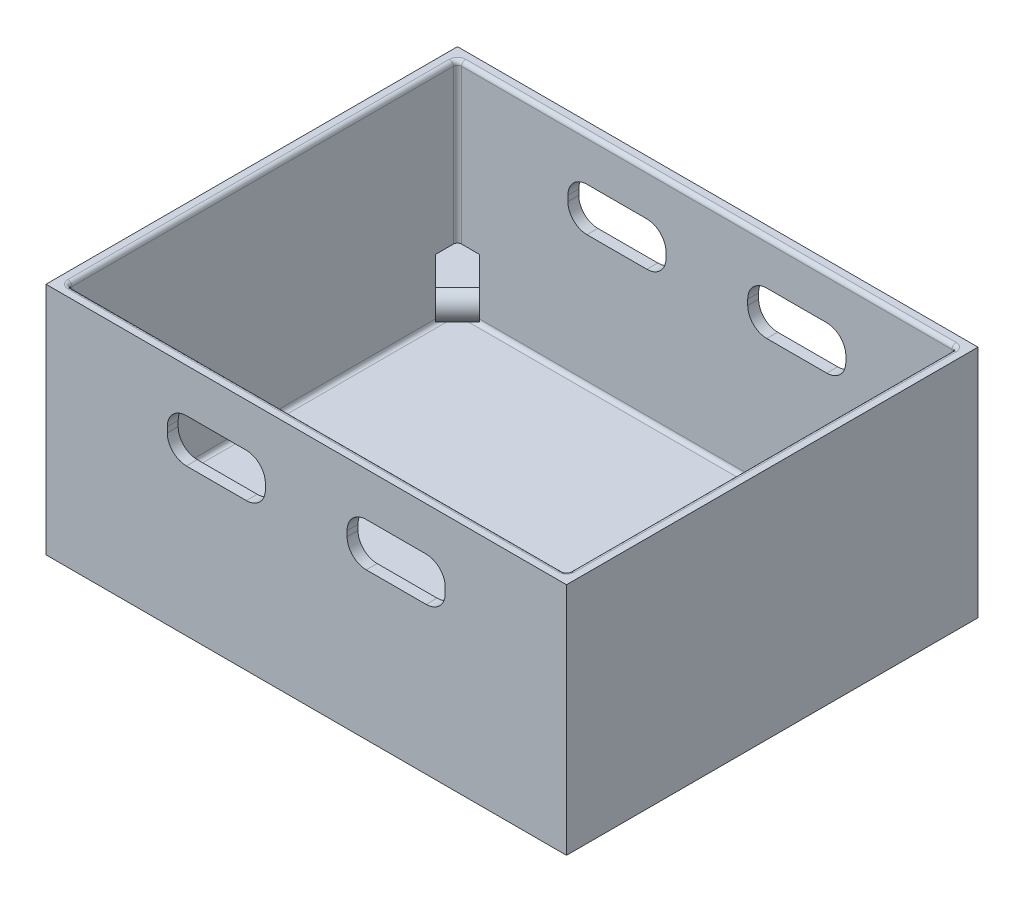
from build123d import *

# Parameters (mm, degrees)
SKETCH1_W            = 95.5
SKETCH1_H            = 75.5
SKETCH1_W_2          = 91.5
SKETCH1_H_2          = 71.5
EXTRUDE_THIN1_DEPTH  = 40
SKETCH2_W            = 95.5
SKETCH2_H            = 75.5
BOSS_EXTRUDE1_DEPTH  = 3
CUT_EXTRUDE1_DEPTH   = 98.879070797
BOSS_EXTRUDE3_START  = 11
BOSS_EXTRUDE3_DEPTH  = 9
CUT_EXTRUDE2_REACH   = 83.241
MIRROR2_START        = 11
MIRROR2_COPY_1_DEPTH = 9
MIRROR2_COPY_2_REACH = 83.241
FILLET3_R            = 0.75
FILLET4_R            = 0.75


with BuildPart() as part:
    # Sketch1 → Extrude-Thin1 (new body)
    with BuildSketch(Plane(origin=(0, 0, 0), x_dir=(1, 0, 0), z_dir=(0, 1, 0))):
        Rectangle(SKETCH1_W, SKETCH1_H)
        Rectangle(SKETCH1_W_2, SKETCH1_H_2, mode=Mode.SUBTRACT)
    extrude(amount=EXTRUDE_THIN1_DEPTH)

    # Sketch2 → Boss-Extrude1 (add)
    with BuildSketch(Plane.XZ):
        Rectangle(SKETCH2_W, SKETCH2_H)
    extrude(amount=BOSS_EXTRUDE1_DEPTH)

    # Sketch4 → Cut-Extrude1 (cut, through all)
    with BuildSketch(Plane.XY.offset(37.75)):
        with BuildLine():
            Line((-22, 32), (-11, 32))
            ThreePointArc((-11, 32), (-8.525126266, 30.974873734), (-7.5, 28.5))
            Line((-7.5, 28.5), (-7.5, 27.5))
            ThreePointArc((-7.5, 27.5), (-8.525126266, 25.025126266), (-11, 24))
            Line((-11, 24), (-22, 24))
            ThreePointArc((-22, 24), (-24.474873734, 25.025126266), (-25.5, 27.5))
            Line((-25.5, 27.5), (-25.5, 28.5))
            ThreePointArc((-25.5, 28.5), (-24.474873734, 30.974873734), (-22, 32))
        make_face()
        with BuildLine():
            Line((11, 32), (22, 32))
            ThreePointArc((22, 32), (24.474873734, 30.974873734), (25.5, 28.5))
            Line((25.5, 28.5), (25.5, 27.5))
            ThreePointArc((25.5, 27.5), (24.474873734, 25.025126266), (22, 24))
            Line((22, 24), (11, 24))
            ThreePointArc((11, 24), (8.525126266, 25.025126266), (7.5, 27.5))
            Line((7.5, 27.5), (7.5, 28.5))
            ThreePointArc((7.5, 28.5), (8.525126266, 30.974873734), (11, 32))
        make_face()
    extrude(amount=-CUT_EXTRUDE1_DEPTH, mode=Mode.SUBTRACT)

    # Sketch7 → Boss-Extrude3 (add)
    with BuildSketch(Plane(origin=(0, 0, 0), x_dir=(1, 0, 0), z_dir=(0, 1, 0)).offset(BOSS_EXTRUDE3_START)):
        Polygon((-45.75, 35.75), (-45.75, 31.75), (-38.678932188, 24.678932188), (-34.678932188, 28.678932188), (-41.75, 35.75), align=None)
    boss_extrude3 = extrude(amount=-BOSS_EXTRUDE3_DEPTH)

    # Sketch8 → Cut-Extrude2 (cut, up to next)
    with BuildSketch(Plane(origin=(-7, 0, 7), x_dir=(0.7071067811865489, 0, 0.7071067811865461), z_dir=(-0.7071067811865461, 0, 0.7071067811865489)), mode=Mode.PRIVATE) as cut_extrude2_sk1:
        with BuildLine():
            ThreePointArc((-47.300775542, 11), (-45.423796616, 8.62675879), (-46.800775542, 5.932458739))
            Line((-46.800775542, 5.932458739), (-53.550775542, 2))
            Line((-53.550775542, 2), (-44.800775542, 2))
            Line((-44.800775542, 2), (-44.800775542, 11))
            Line((-44.800775542, 11), (-47.300775542, 11))
        make_face()
    cut_extrude2_tool1 = extrude(cut_extrude2_sk1.sketch, amount=-CUT_EXTRUDE2_REACH, mode=Mode.PRIVATE) & part.part
    cut_extrude2 = cut_extrude2_tool1.solids().sort_by_distance((-40.481625, 4.582192, -26.481625))[0]
    add(cut_extrude2, mode=Mode.SUBTRACT)

    # Mirror1: Boss-Extrude3, Cut-Extrude2 across plane
    add(boss_extrude3.mirror(Plane.XY))
    add(cut_extrude2.mirror(Plane.XY), mode=Mode.SUBTRACT)

    # Mirror2: Boss-Extrude3, Cut-Extrude2 across plane
    add(boss_extrude3.mirror(Plane(origin=(0, 0, 0), x_dir=(0, 0, 1), z_dir=(1, 0, 0))))
    add(cut_extrude2.mirror(Plane(origin=(0, 0, 0), x_dir=(0, 0, 1), z_dir=(1, 0, 0))), mode=Mode.SUBTRACT)

    # Mirror2 copy 1 sketch → Mirror2 copy 1 (add)
    with BuildSketch(Plane(origin=(0, 0, 0), x_dir=(-1, 0, 0), z_dir=(0, 1, 0)).offset(MIRROR2_START)):
        Polygon((-45.75, 35.75), (-45.75, 31.75), (-38.678932188, 24.678932188), (-34.678932188, 28.678932188), (-41.75, 35.75), align=None)
    extrude(amount=-MIRROR2_COPY_1_DEPTH)

    # Mirror2 copy 2 sketch → Mirror2 copy 2 (cut, up to next)
    with BuildSketch(Plane(origin=(7, 0, -7), x_dir=(-0.7071067811865489, 0, -0.7071067811865461), z_dir=(0.7071067811865461, 0, -0.7071067811865489)), mode=Mode.PRIVATE) as mirror2_copy_2_sk1:
        with BuildLine():
            ThreePointArc((-47.300775542, 11), (-45.423796616, 8.62675879), (-46.800775542, 5.932458739))
            Line((-46.800775542, 5.932458739), (-53.550775542, 2))
            Line((-53.550775542, 2), (-44.800775542, 2))
            Line((-44.800775542, 2), (-44.800775542, 11))
            Line((-44.800775542, 11), (-47.300775542, 11))
        make_face()
    mirror2_copy_2_tool1 = extrude(mirror2_copy_2_sk1.sketch, amount=-MIRROR2_COPY_2_REACH, mode=Mode.PRIVATE) & part.part
    add(mirror2_copy_2_tool1.solids().sort_by_distance((40.481625, 4.582192, 26.481625))[0], mode=Mode.SUBTRACT)

    # Fillet3
    fillet3_edges = [part.edges().sort_by_distance(p)[0] for p in [
        (-45.75, 0, 0),
        (0, 0, 35.75),
        (45.75, 0, 0),
        (0, 0, -35.75),
        (45.75, 25.5, 35.75),
        (45.75, 25.5, -35.75),
        (-45.75, 25.5, -35.75),
        (-45.75, 25.5, 35.75),
    ]]
    fillet(fillet3_edges, radius=FILLET3_R)

    # Fillet4
    fillet4_edges = [part.edges().sort_by_distance(p)[0] for p in [
        (-45.530330086, 40, -35.530330086),
        (0, 40, -35.75),
        (45.530330086, 40, -35.530330086),
        (45.75, 40, 0),
        (45.530330086, 40, 35.530330086),
        (0, 40, 35.75),
        (-45.530330086, 40, 35.530330086),
        (-45.75, 40, 0),
    ]]
    fillet(fillet4_edges, radius=FILLET4_R)


solid = part.part
